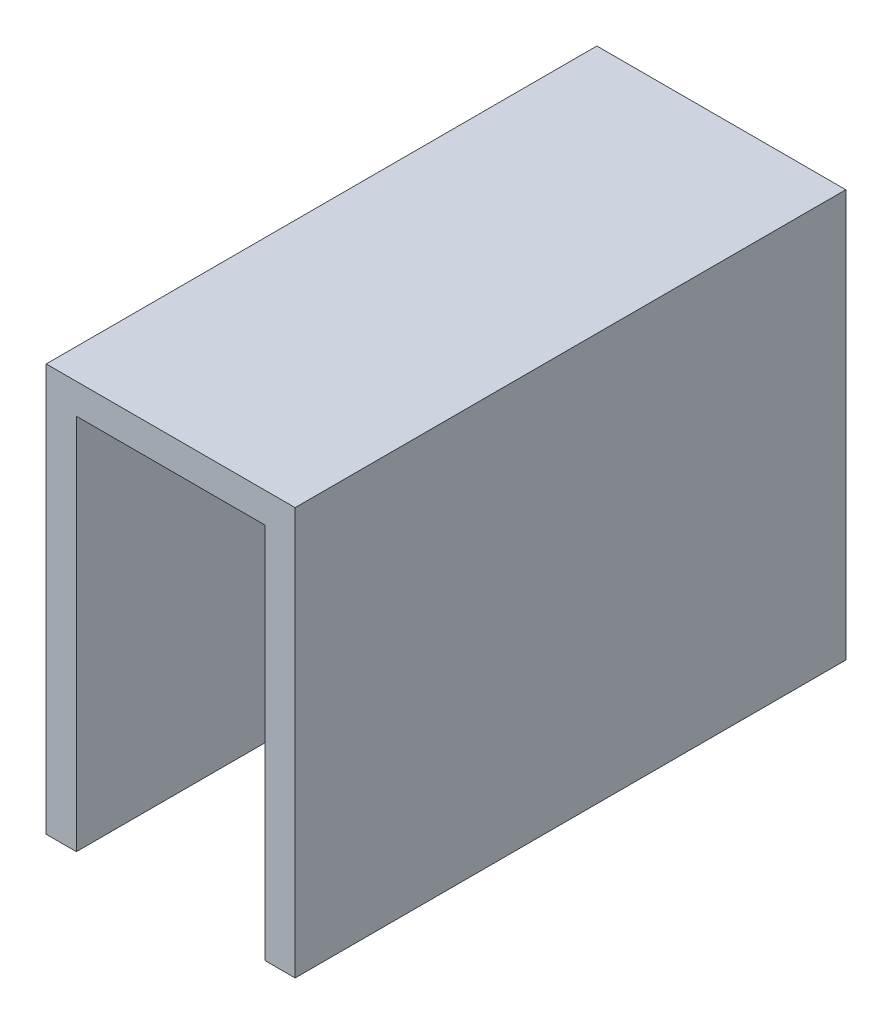
from build123d import *

# Parameters (mm, degrees)
CROQUIS1_W              = 33
CROQUIS1_H              = 58
CROQUIS1_W_2            = 25
CROQUIS1_H_2            = 50
SALIENTE_EXTRUIR1_DEPTH = 70
CROQUIS2_W              = 33
CROQUIS2_H              = 58
SALIENTE_EXTRUIR2_DEPTH = 3
CROQUIS3_W              = 33
CROQUIS3_H              = 4
CORTAR_EXTRUIR1_DEPTH   = 81.263628126


with BuildPart() as part:
    # Croquis1 → Saliente-Extruir1 (new body)
    with BuildSketch(Plane.XY):
        Rectangle(CROQUIS1_W, CROQUIS1_H)
        Rectangle(CROQUIS1_W_2, CROQUIS1_H_2, mode=Mode.SUBTRACT)
    extrude(amount=SALIENTE_EXTRUIR1_DEPTH)

    # Croquis2 → Saliente-Extruir2 (add)
    with BuildSketch(Plane(origin=(0, 0, 0), x_dir=(-1, 0, 0), z_dir=(0, 0, -1))):
        Rectangle(CROQUIS2_W, CROQUIS2_H)
    extrude(amount=SALIENTE_EXTRUIR2_DEPTH)

    # Croquis3 → Cortar-Extruir1 (cut, through all)
    with BuildSketch(Plane.XY.offset(70)):
        with Locations((0, -27)):
            Rectangle(CROQUIS3_W, CROQUIS3_H)
    extrude(amount=-CORTAR_EXTRUIR1_DEPTH, mode=Mode.SUBTRACT)


solid = part.part
